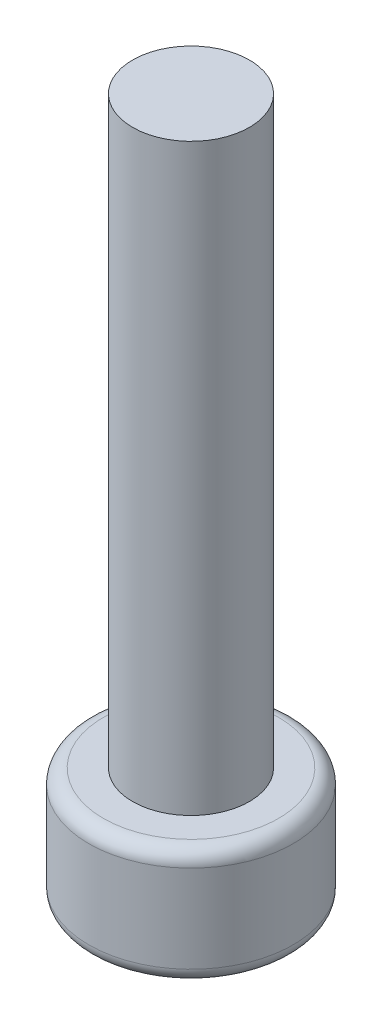
from build123d import *

# Parameters (mm, degrees)
SKETCH_1_R          = 3.5
EXTRUDE_1_DEPTH     = 4
SKETCH_2_R          = 2
EXTRUDE_2_DEPTH     = 20
CUT_EXTRUDE_1_DEPTH = 2
FILLET_1_R          = 0.5


with BuildPart() as part:
    # 草图1 → 凸台-拉伸1 (new body)
    with BuildSketch(Plane(origin=(0, 0, 0), x_dir=(1, 0, 0), z_dir=(0, 1, 0))):
        with Locations(Location((0, 0, 0), (0, 0, 270))):
            Circle(SKETCH_1_R)
    extrude(amount=EXTRUDE_1_DEPTH)

    # 草图2 → 凸台-拉伸2 (add)
    with BuildSketch(Plane(origin=(0, 4, 0), x_dir=(1, 0, 0), z_dir=(0, 1, 0))):
        with Locations(Location((0, 0, 0), (0, 0, 270))):
            Circle(SKETCH_2_R)
    extrude(amount=EXTRUDE_2_DEPTH)

    # 草图3 → 切除-拉伸1 (cut)
    with BuildSketch(Plane.XZ):
        Polygon((1.5, 0), (0.75, 1.299038106), (-0.75, 1.299038106), (-1.5, 0), (-0.75, -1.299038106), (0.75, -1.299038106), align=None)
    extrude(amount=-CUT_EXTRUDE_1_DEPTH, mode=Mode.SUBTRACT)

    # 圆角1
    fillet_1_edges = [part.edges().sort_by_distance(p)[0] for p in [
        (0, 0, -3.5),
        (0, 4, -3.5),
    ]]
    fillet(fillet_1_edges, radius=FILLET_1_R)


solid = part.part
